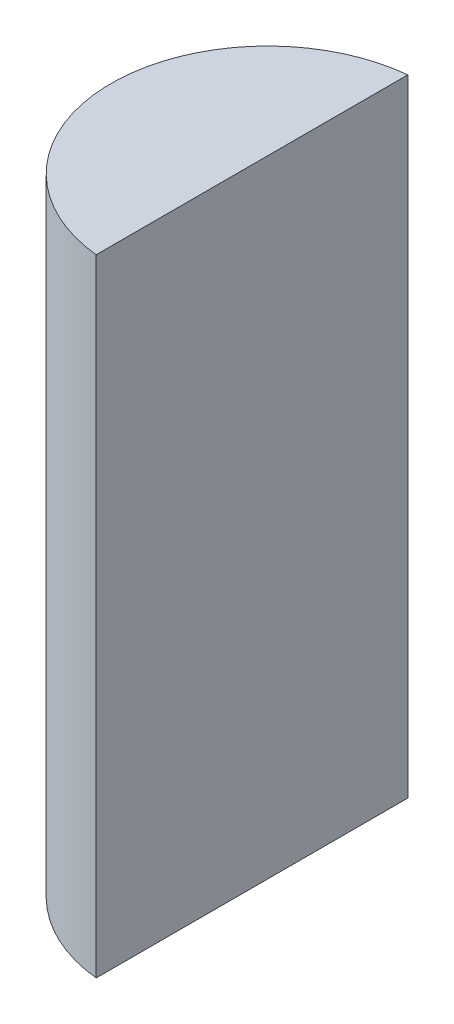
from build123d import *

# Parameters (mm, degrees)
BOSS_EXTRUDE1_DEPTH = 200


with BuildPart() as part:
    # Sketch1 → Boss-Extrude1 (new body)
    with BuildSketch(Plane(origin=(0, 0, 0), x_dir=(1, 0, 0), z_dir=(0, 1, 0))):
        with BuildLine():
            Line((-5, 49.749371855), (-5, -49.749371855))
            ThreePointArc((-5, -49.749371855), (-50, 0), (-5, 49.749371855))
        make_face()
    extrude(amount=BOSS_EXTRUDE1_DEPTH)


solid = part.part
